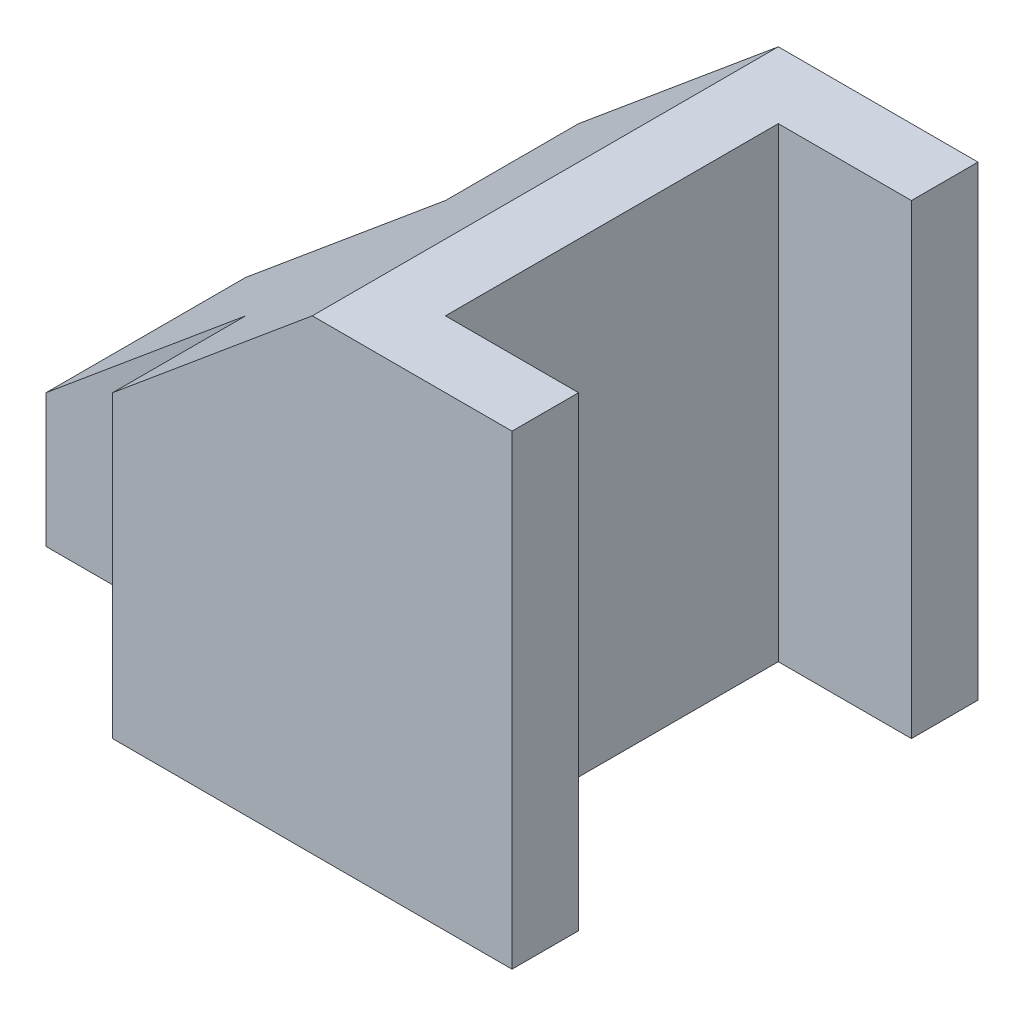
from build123d import *

# Parameters (mm, degrees)
BOSS_EXTRUDE1_DEPTH = 35000
SKETCH3_W           = 10000
SKETCH3_H           = 25000
CUT_EXTRUDE1_DEPTH  = 66896.440801298
CUT_EXTRUDE2_DEPTH  = 10000
CUT_EXTRUDE3_DEPTH  = 10000


with BuildPart() as part:
    # Sketch1 → Boss-Extrude1 (new body)
    with BuildSketch(Plane.XY):
        Polygon((0, 0), (45000, 0), (45000, 35000), (30000, 35000), (0, 10000), align=None)
    extrude(amount=-BOSS_EXTRUDE1_DEPTH)

    # Sketch3 → Cut-Extrude1 (cut, through all)
    with BuildSketch(Plane(origin=(0, 35000, 0), x_dir=(1, 0, 0), z_dir=(0, 1, 0))):
        with Locations((40000, 17500)):
            Rectangle(SKETCH3_W, SKETCH3_H)
    extrude(amount=-CUT_EXTRUDE1_DEPTH, mode=Mode.SUBTRACT)

    # Sketch4 → Cut-Extrude2 (cut)
    with BuildSketch(Plane.XY):
        Polygon((0, 0), (15000, 0), (15000, 22500), (0, 10000), align=None)
    extrude(amount=-CUT_EXTRUDE2_DEPTH, mode=Mode.SUBTRACT)

    # Sketch5 → Cut-Extrude3 (cut)
    with BuildSketch(Plane(origin=(0, 0, -35000), x_dir=(-1, 0, 0), z_dir=(0, 0, -1))):
        Polygon((0, 10000), (-15000, 22500), (-15000, 0), (0, 0), align=None)
    extrude(amount=-CUT_EXTRUDE3_DEPTH, mode=Mode.SUBTRACT)


solid = part.part
